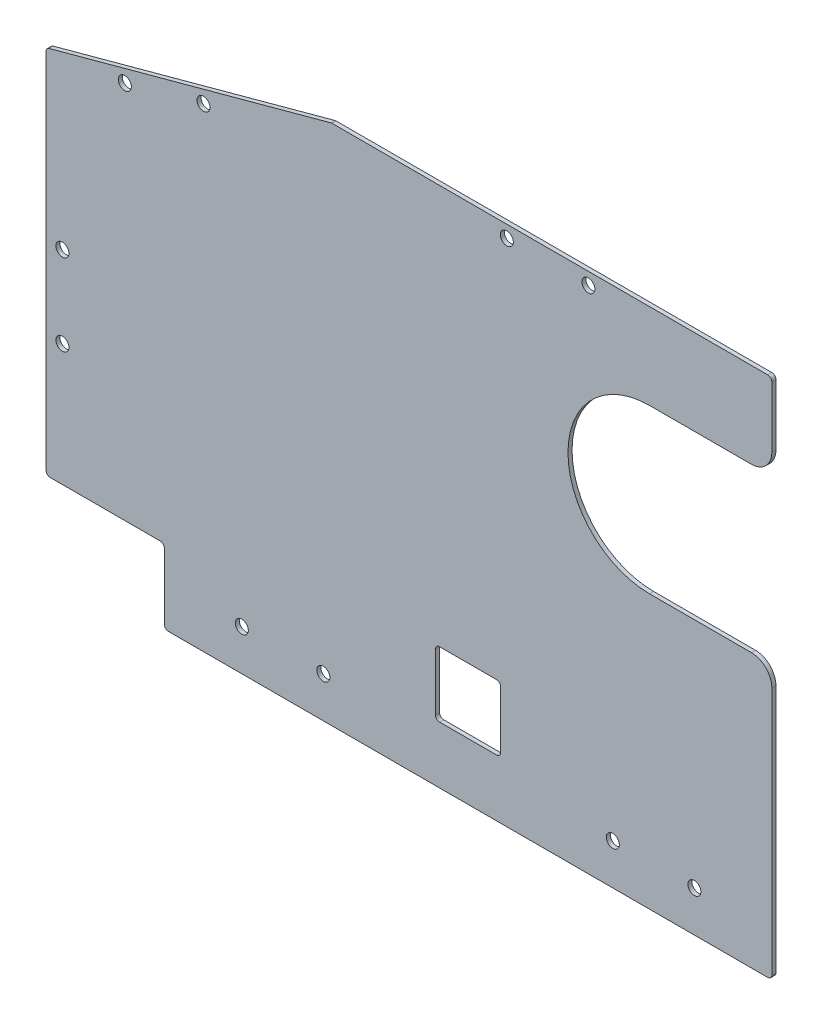
from build123d import *

# Parameters (mm, degrees)
SKETCH_1_W          = 90
SKETCH_1_H          = 14
EXTRUDE_1_DEPTH     = 1
EXTRUDE_2_DEPTH     = 1
SKETCH_4_W          = 40
SKETCH_4_H          = 14
SKETCH_4_W_2        = 19
EXTRUDE_3_DEPTH     = 1
SKETCH_7_R          = 1.6
CUT_EXTRUDE_1_DEPTH = 10
SKETCH_9_R          = 1.6
CUT_EXTRUDE_3_DEPTH = 10
EXTRUDE_4_DEPTH     = 1
CUT_EXTRUDE_4_DEPTH = 10
SKETCH_13_R         = 1.6
CUT_EXTRUDE_5_DEPTH = 10
CUT_EXTRUDE_6_DEPTH = 10
FILLET_1_R          = 5
FILLET_2_R          = 1
SKETCH_15_W         = 16
SKETCH_15_H         = 16
CUT_EXTRUDE_7_DEPTH = 10
FILLET_3_R          = 1


with BuildPart() as part:
    # 草图1 → 凸台-拉伸1 (new body)
    with BuildSketch(Plane.XY):
        with Locations((0, -3)):
            Rectangle(SKETCH_1_W, SKETCH_1_H)
    extrude(amount=EXTRUDE_1_DEPTH)

    # 草图2 → 凸台-拉伸2 (add)
    with BuildSketch(Plane.XY.offset(1)):
        Polygon((-85, 8.2), (-85, 4), (64, 4), (64, 118), (-114, 98), (-114, 8.2), align=None)
    extrude(amount=-EXTRUDE_2_DEPTH)

    # 草图4 → 凸台-拉伸3 (add)
    with BuildSketch(Plane.XY.offset(1)):
        with Locations((-65, -3)):
            Rectangle(SKETCH_4_W, SKETCH_4_H)
        with Locations((54.5, -3)):
            Rectangle(SKETCH_4_W_2, SKETCH_4_H)
    extrude(amount=-EXTRUDE_3_DEPTH)

    # 草图7 → 切除-拉伸1 (cut)
    with BuildSketch(Plane.XY.offset(1)):
        with Locations((45, 0)):
            Circle(SKETCH_7_R)
        with Locations((25, 0)):
            Circle(SKETCH_7_R)
        with Locations((-66, 0)):
            Circle(SKETCH_7_R)
        with Locations((-46, 0)):
            Circle(SKETCH_7_R)
    extrude(amount=-CUT_EXTRUDE_1_DEPTH, mode=Mode.SUBTRACT)

    # 草图9 → 切除-拉伸3 (cut)
    with BuildSketch(Plane(origin=(0, 0, 0), x_dir=(-1, 0, 0), z_dir=(0, 0, -1))):
        with Locations((110, 58.1)):
            Circle(SKETCH_9_R)
        with Locations((110, 38.1)):
            Circle(SKETCH_9_R)
    extrude(amount=-CUT_EXTRUDE_3_DEPTH, mode=Mode.SUBTRACT)

    # 草图10 → 凸台-拉伸4 (add)
    with BuildSketch(Plane.XY.offset(1)):
        Polygon((-114, 98), (-114, 118), (64, 118), align=None)
    extrude(amount=-EXTRUDE_4_DEPTH)

    # 草图11 → 切除-拉伸4 (cut)
    with BuildSketch(Plane.XY.offset(1)):
        Polygon((-44, 118), (-114, 118), (-114, 99), align=None)
    extrude(amount=-CUT_EXTRUDE_4_DEPTH, mode=Mode.SUBTRACT)

    # 草图13 → 切除-拉伸5 (cut)
    with BuildSketch(Plane.XY.offset(1)):
        with Locations((-1, 115)):
            Circle(SKETCH_13_R)
        with Locations((19, 115)):
            Circle(SKETCH_13_R)
        with Locations((-75.396749016, 106.369478786)):
            Circle(SKETCH_13_R)
        with Locations((-94.698374508, 101.130466152)):
            Circle(SKETCH_13_R)
    extrude(amount=-CUT_EXTRUDE_5_DEPTH, mode=Mode.SUBTRACT)

    # 草图14 → 切除-拉伸6 (cut)
    with BuildSketch(Plane(origin=(0, 0, 0), x_dir=(-1, 0, 0), z_dir=(0, 0, -1))):
        with BuildLine():
            Line((-94, 97), (-34, 97))
            ThreePointArc((-34, 97), (-14, 77), (-34, 57))
            Line((-34, 57), (-94, 57))
            ThreePointArc((-94, 57), (-114, 77), (-94, 97))
        make_face()
    extrude(amount=-CUT_EXTRUDE_6_DEPTH, mode=Mode.SUBTRACT)

    # 圆角1
    fillet_1_edges = [part.edges().sort_by_distance(p)[0] for p in [
        (64, 57, 0.5),
        (64, 97, 0.5),
    ]]
    fillet(fillet_1_edges, radius=FILLET_1_R)

    # 圆角2
    fillet_2_edges = [part.edges().sort_by_distance(p)[0] for p in [
        (-44, 118, 0.5),
        (-114, 99, 0.5),
        (-114, 8.2, 0.5),
        (64, 118, 0.5),
        (-85, 8.2, 0.5),
        (-85, -10, 0.5),
        (64, -10, 0.5),
    ]]
    fillet(fillet_2_edges, radius=FILLET_2_R)

    # 草图15 → 切除-拉伸7 (cut)
    with BuildSketch(Plane.XY.offset(1)):
        with Locations((-10.5, 12)):
            Rectangle(SKETCH_15_W, SKETCH_15_H)
    extrude(amount=-CUT_EXTRUDE_7_DEPTH, mode=Mode.SUBTRACT)

    # 圆角3
    fillet_3_edges = [part.edges().sort_by_distance(p)[0] for p in [
        (-2.5, 20, 0.5),
        (-2.5, 4, 0.5),
        (-18.5, 4, 0.5),
        (-18.5, 20, 0.5),
    ]]
    fillet(fillet_3_edges, radius=FILLET_3_R)


solid = part.part
